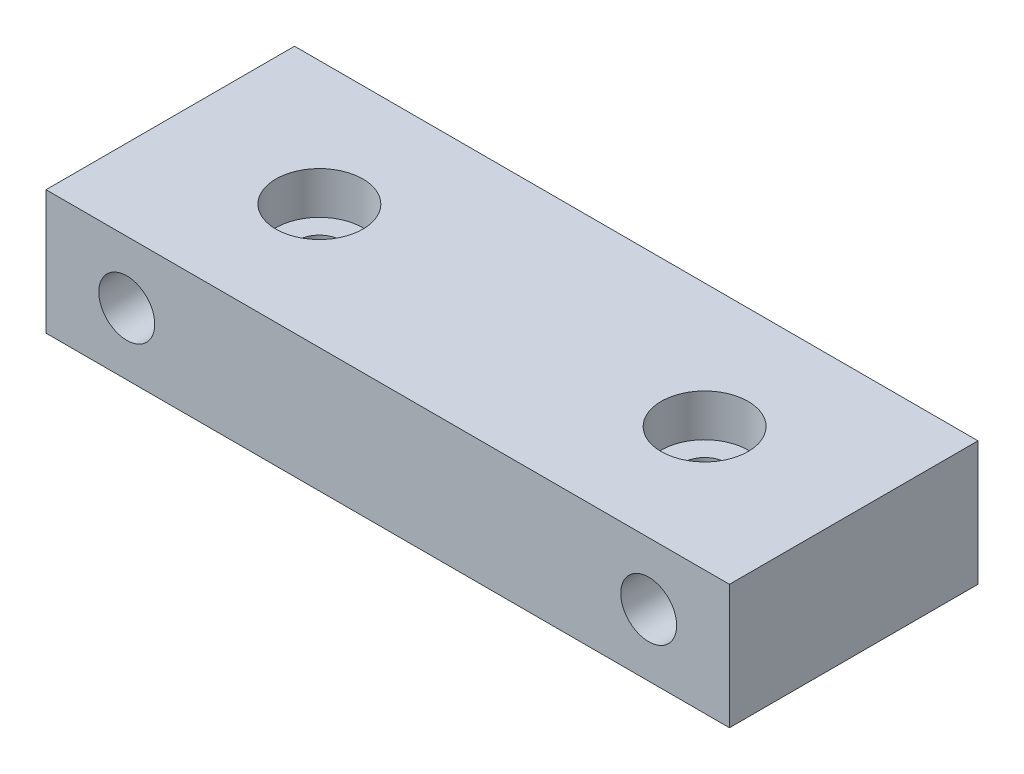
from build123d import *

# Parameters (mm, degrees)
SKETCH1_W                                           = 55
SKETCH1_H                                           = 20
BOSS_EXTRUDE1_DEPTH                                 = 10
SKETCH2_R                                           = 2.25
CUT_EXTRUDE1_DEPTH                                  = 36.443617197
SKETCH3_R                                           = 1.75
CUT_EXTRUDE2_DEPTH                                  = 31.923292192
CBORE_FOR_M3_HEX_SOCKET_HEAD_CAP_SCREW1_D           = 3.4
CBORE_FOR_M3_HEX_SOCKET_HEAD_CAP_SCREW1_CBORE_D     = 7
CBORE_FOR_M3_HEX_SOCKET_HEAD_CAP_SCREW1_CBORE_DEPTH = 3.4
CUT_EXTRUDE3_DEPTH                                  = 4


with BuildPart() as part:
    # Sketch1 → Boss-Extrude1 (new body)
    with BuildSketch(Plane(origin=(0, 0, 0), x_dir=(1, 0, 0), z_dir=(0, 1, 0))):
        Rectangle(SKETCH1_W, SKETCH1_H)
    extrude(amount=BOSS_EXTRUDE1_DEPTH)

    # Sketch2 → Cut-Extrude1 (cut, through all)
    with BuildSketch(Plane.XY.offset(10)):
        with Locations((-21, 5)):
            Circle(SKETCH2_R)
        with Locations((21, 5)):
            Circle(SKETCH2_R)
    extrude(amount=-CUT_EXTRUDE1_DEPTH, mode=Mode.SUBTRACT)

    # Sketch3 → Cut-Extrude2 (cut, through all)
    with BuildSketch(Plane(origin=(0, 10, 0), x_dir=(1, 0, 0), z_dir=(0, 1, 0))):
        with Locations(Location((-15.5, 0, 0), (0, 0, 270))):
            Circle(SKETCH3_R)
        with Locations(Location((15.5, 0, 0), (0, 0, 270))):
            Circle(SKETCH3_R)
    extrude(amount=-CUT_EXTRUDE2_DEPTH, mode=Mode.SUBTRACT)

    # CBORE for M3 Hex Socket Head Cap Screw1 (through all)
    with Locations(Plane(origin=(0, 10, 0), x_dir=(1, 0, 0), z_dir=(0, 1, 0))):
        with Locations((-15.5, 0), (15.5, 0)):
            CounterBoreHole(CBORE_FOR_M3_HEX_SOCKET_HEAD_CAP_SCREW1_D / 2, CBORE_FOR_M3_HEX_SOCKET_HEAD_CAP_SCREW1_CBORE_D / 2, CBORE_FOR_M3_HEX_SOCKET_HEAD_CAP_SCREW1_CBORE_DEPTH)

    # Sketch6 → Cut-Extrude3 (cut)
    with BuildSketch(Plane(origin=(0, 0, -10), x_dir=(-1, 0, 0), z_dir=(0, 0, -1))):
        Polygon((-16.727608008, 5), (-18.863804004, 8.7), (-23.136195996, 8.7), (-25.272391992, 5), (-23.136195996, 1.3), (-18.863804004, 1.3), align=None)
        Polygon((16.727608008, 5), (18.863804004, 1.3), (23.136195996, 1.3), (25.272391992, 5), (23.136195996, 8.7), (18.863804004, 8.7), align=None)
    extrude(amount=-CUT_EXTRUDE3_DEPTH, mode=Mode.SUBTRACT)


solid = part.part
